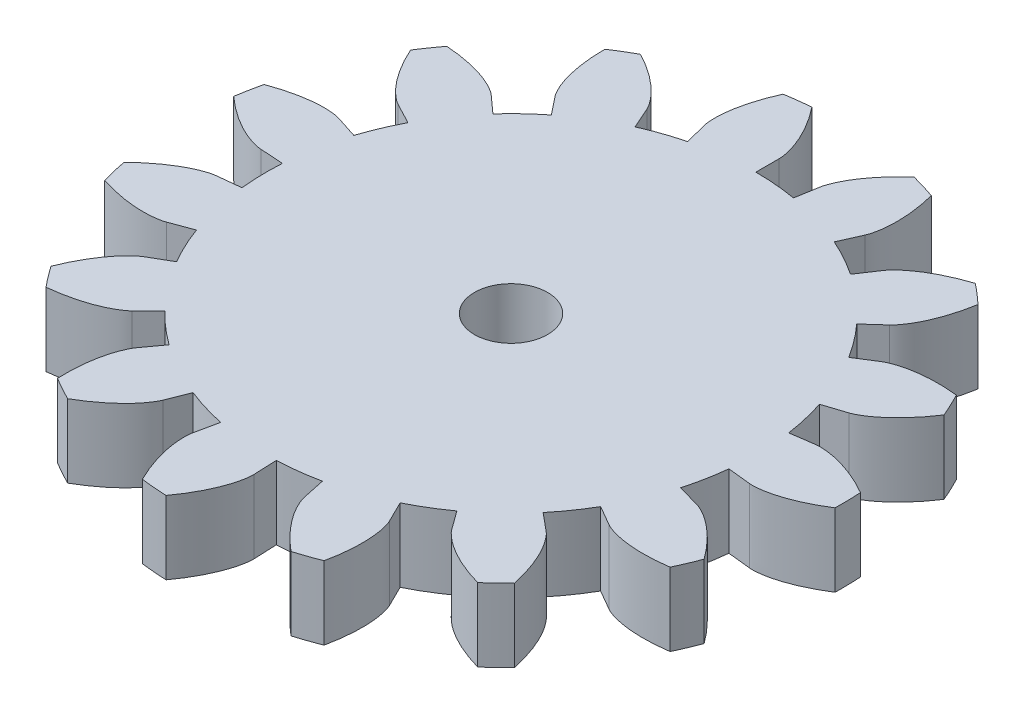
from build123d import *

# Parameters (mm, degrees)
GEAR_BILLET_R             = 13.5525
GEAR_BILLET_EXTRUDE_DEPTH = 3
CUT_TOOTH_PROFILE_REACH   = 21.399
DUPLICATE_TEETH_COUNT     = 15
SKETCH1_R                 = 1.5
CUT_EXTRUDE1_DEPTH        = 20.389822918


with BuildPart() as part:
    # Gear billet → Gear billet Extrude (new body)
    with BuildSketch(Plane(origin=(0, 0, 0), x_dir=(1, 0, 0), z_dir=(0, 1, 0))):
        with Locations(Location((0, 0, 0), (0, 0, 270))):
            Circle(GEAR_BILLET_R)
    extrude(amount=GEAR_BILLET_EXTRUDE_DEPTH)

    # Tooth profile → Cut tooth profile (cut, up to next)
    with BuildSketch(Plane(origin=(0, 3, 0), x_dir=(1, 0, 0), z_dir=(0, 1, 0)), mode=Mode.PRIVATE) as cut_tooth_profile_sk1:
        with BuildLine():
            Line((0, 10.994403663), (0, 10.0425))
            ThreePointArc((0, 10.0425), (0.847456117, 10.006678989), (1.68886658, 9.899471497))
            Line((1.68886658, 9.899471497), (1.848950054, 10.837817843))
            add(Edge.make_bspline(
                [(1.848950054, 10.837817843), (1.854654318, 10.871253999), (1.875059163, 10.964086076), (1.931487221, 11.136715155), (2.047260652, 11.408015433), (2.231545748, 11.743123569), (2.506193489, 12.15060416), (2.837154559, 12.552270491), (3.119999084, 12.844167157), (3.328551966, 13.038723365), (3.414061824, 13.115427485)],
                knots=[0, 0, 0, 0, 0, 0.005604071, 0.015718253, 0.029959921, 0.048733673, 0.068727069, 0.096888899, 0.115885683, 0.115885683, 0.115885683, 0.115885683, 0.115885683], degree=4))
            ThreePointArc((3.414061824, 13.115427485), (1.143654371, 13.504159023), (-1.159790944, 13.502782721))
            add(Edge.make_bspline(
                [(0, 10.994403663), (0, 11.028322907), (-0.004502483, 11.123264362), (-0.031095509, 11.302924418), (-0.099594968, 11.589830592), (-0.224899636, 11.95115759), (-0.427108958, 12.399022752), (-0.685807374, 12.850626783), (-0.915534712, 13.185932672), (-1.088398424, 13.412790688), (-1.159790944, 13.502782721)],
                knots=[0, 0, 0, 0, 0, 0.005604071, 0.015718253, 0.029959921, 0.048733673, 0.068727069, 0.096888899, 0.115885683, 0.115885683, 0.115885683, 0.115885683, 0.115885683], degree=4))
        make_face()
    cut_tooth_profile_tool1 = extrude(cut_tooth_profile_sk1.sketch, amount=-CUT_TOOTH_PROFILE_REACH, mode=Mode.PRIVATE) & part.part
    cut_tooth_profile = cut_tooth_profile_tool1.solids().sort_by_distance((1.020097, 3, -12.045209))[0]
    add(cut_tooth_profile, mode=Mode.SUBTRACT)

    # Duplicate teeth: Cut tooth profile ×15 about axis
    duplicate_teeth_axis = Axis((0, 3, 0), (0, -1, 0))
    for i in range(1, DUPLICATE_TEETH_COUNT):
        add(cut_tooth_profile.rotate(duplicate_teeth_axis, i * 360 / DUPLICATE_TEETH_COUNT), mode=Mode.SUBTRACT)

    # Sketch1 → Cut-Extrude1 (cut, through all)
    with BuildSketch(Plane(origin=(0, 3, 0), x_dir=(1, 0, 0), z_dir=(0, 1, 0))):
        with Locations(Location((0, 0, 0), (0, 0, 270))):
            Circle(SKETCH1_R)
    extrude(amount=-CUT_EXTRUDE1_DEPTH, mode=Mode.SUBTRACT)


solid = part.part
